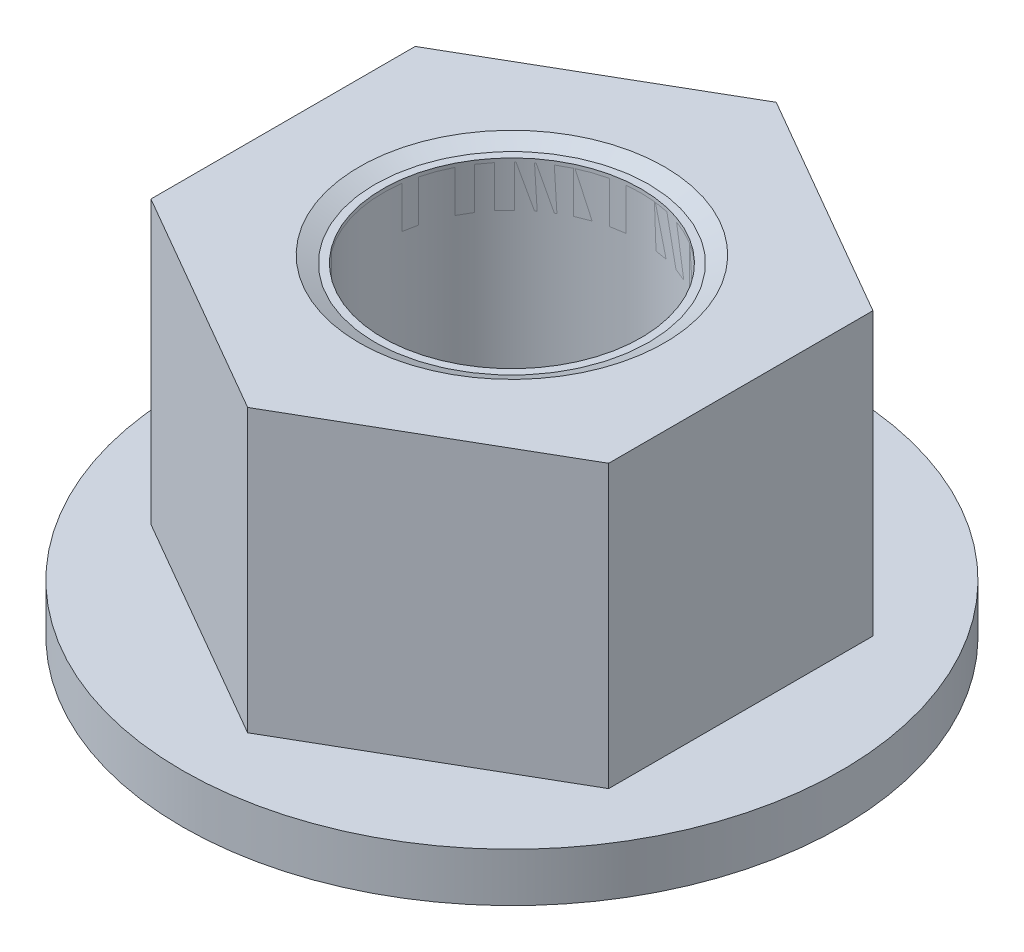
from build123d import *

# Parameters (mm, degrees)
EXTRUDE1_DEPTH = 10.31875
SKETCH8_W      = 10.287
SKETCH8_H      = 1.524


with BuildPart() as part:
    # Sketch1 → Extrude1 (new body)
    with BuildSketch(Plane(origin=(0, 0, 0), x_dir=(1, 0, 0), z_dir=(0, 1, 0))):
        Polygon((0, 8.248891971), (-7.14375, 4.124445986), (-7.14375, -4.124445986), (0, -8.248891971), (7.14375, -4.124445986), (7.14375, 4.124445986), align=None)
    extrude(amount=EXTRUDE1_DEPTH)

    # Sketch8 → Revolve3 (revolve)
    with BuildSketch(Plane(origin=(0, 0, 0), x_dir=(0, 0, -1), z_dir=(1, 0, 0)), mode=Mode.PRIVATE) as revolve3_sk:
        with Locations((5.1435, 0.762)):
            Rectangle(SKETCH8_W, SKETCH8_H)
    revolve(revolve3_sk.sketch.rotate(Axis((0, 0, 0), (0, -1, 0)), 180), axis=Axis((0, 0, 0), (0, -1, 0)))

    # Sketch4 → Cut-Revolve2 (revolve, cut)
    with BuildSketch(Plane(origin=(0, 0, 0), x_dir=(0, 0, -1), z_dir=(1, 0, 0))):
        Polygon((0, 10.31875), (4.7625, 10.31875), (4.029111805, 9.976765468), (4.029111805, 0.341984532), (4.7625, 0), (0, 0), align=None)
    revolve(axis=Axis((0, 10.31875, 0), (0, 1, 0)), mode=Mode.SUBTRACT)


with BuildPart() as body_2:
    # Sketch7 → Revolve2 (revolve)
    with BuildSketch(Plane(origin=(0, 0, 0), x_dir=(0, 0, -1), z_dir=(1, 0, 0))):
        with BuildLine():
            Line((4.029111805, 8.675158333), (6.913201815, 8.675158333))
            ThreePointArc((6.913201815, 8.675158333), (6.451096051, 9.679995195), (5.423958333, 10.09015))
            Line((5.423958333, 10.09015), (4.029111805, 10.09015))
            Line((4.029111805, 10.09015), (4.029111805, 8.675158333))
        make_face()
    revolve(axis=Axis((0, 8.675158333, 0), (0, 1, 0)))


solid = Compound([part.part, body_2.part])
